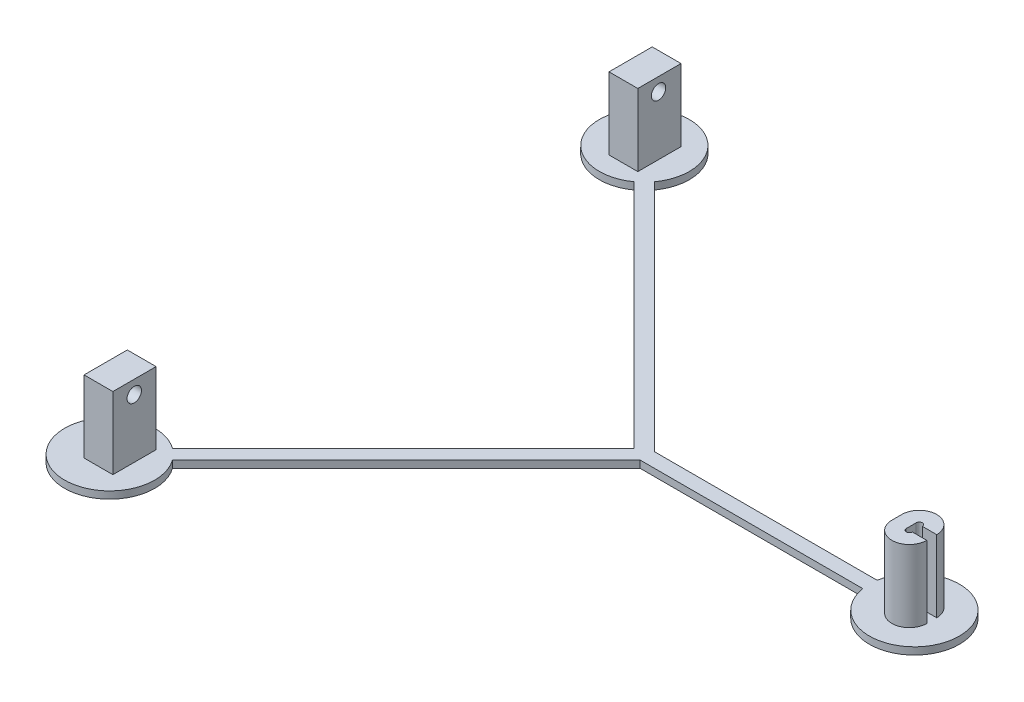
from build123d import *

# Parameters (mm, degrees)
BOSS_EXTRUDE1_DEPTH = 2
SKETCH2_W           = 8
SKETCH2_H           = 12
BOSS_EXTRUDE2_DEPTH = 20
SKETCH6_W           = 4
SKETCH6_H           = 2.75
CUT_EXTRUDE3_DEPTH  = 20
SKETCH7_R           = 2
CUT_EXTRUDE4_DEPTH  = 10


with BuildPart() as part:
    # Sketch1 → Boss-Extrude1 (new body)
    with BuildSketch(Plane(origin=(0, 0, 0), x_dir=(1, 0, 0), z_dir=(0, 1, 0))):
        with BuildLine():
            Line((75.074639149, 80.253787975), (10.139177746, 145.189249379))
            ThreePointArc((10.139177746, 145.189249379), (-8.838834765, 161.338834765), (7.310750621, 142.360822254))
            Line((7.310750621, 142.360822254), (71.4177849, 78.253787975))
            Line((71.4177849, 78.253787975), (7.310750621, 14.146753697))
            ThreePointArc((7.310750621, 14.146753697), (-8.838834765, -4.831258814), (10.139177746, 11.318326572))
            Line((10.139177746, 11.318326572), (75.074639149, 76.253787975))
            Line((75.074639149, 76.253787975), (136.907249345, 76.253787975))
            ThreePointArc((136.907249345, 76.253787975), (161.746212025, 78.253787975), (136.907249345, 80.253787975))
            Line((136.907249345, 80.253787975), (75.074639149, 80.253787975))
        make_face()
    extrude(amount=BOSS_EXTRUDE1_DEPTH)

    # Sketch2 → Boss-Extrude2 (add)
    # profile 1 of 3: a face of its own
    with BuildSketch(Plane(origin=(0, 2, 0), x_dir=(1, 0, 0), z_dir=(0, 1, 0))):
        with BuildLine():
            Line((144.496212025, 76.753787975), (144.496212025, 79.503787975))
            ThreePointArc((144.496212025, 79.503787975), (149.346212025, 84.353787975), (154.196212025, 79.503787975))
            Line((154.196212025, 79.503787975), (154.196212025, 76.753787975))
            ThreePointArc((154.196212025, 76.753787975), (149.346212025, 71.903787975), (144.496212025, 76.753787975))
        make_face()
        with BuildLine():
            Line((148.496212025, 76.753787975), (148.496212025, 79.503787975))
            ThreePointArc((148.496212025, 79.503787975), (149.346212025, 80.353787975), (150.196212025, 79.503787975))
            Line((150.196212025, 79.503787975), (150.196212025, 76.753787975))
            ThreePointArc((150.196212025, 76.753787975), (149.346212025, 75.903787975), (148.496212025, 76.753787975))
        make_face(mode=Mode.SUBTRACT)
    # profile 2 of 3: a face of its own
    with BuildSketch(Plane(origin=(0, 2, 0), x_dir=(1, 0, 0), z_dir=(0, 1, 0))):
        with Locations((1.381469518, 5.521849013)):
            Rectangle(SKETCH2_W, SKETCH2_H)
    # profile 3 of 3: a face of its own
    with BuildSketch(Plane(origin=(0, 2, 0), x_dir=(1, 0, 0), z_dir=(0, 1, 0))):
        with Locations((1.381469518, 151.304233441)):
            Rectangle(SKETCH2_W, SKETCH2_H)
    extrude(amount=BOSS_EXTRUDE2_DEPTH)

    # Sketch6 → Cut-Extrude3 (cut)
    with BuildSketch(Plane(origin=(0, 22, 0), x_dir=(1, 0, 0), z_dir=(0, 1, 0))):
        with Locations((152.196212025, 78.128787975)):
            Rectangle(SKETCH6_W, SKETCH6_H)
    extrude(amount=-CUT_EXTRUDE3_DEPTH, mode=Mode.SUBTRACT)

    # Sketch7 → Cut-Extrude4 (cut)
    with BuildSketch(Plane.ZY.offset(2.618530482)):
        with Locations((-5.454118169, 18.296936601)):
            Circle(SKETCH7_R)
        with Locations((-151.053457781, 18.296936601)):
            Circle(SKETCH7_R)
    extrude(amount=-CUT_EXTRUDE4_DEPTH, mode=Mode.SUBTRACT)


solid = part.part
